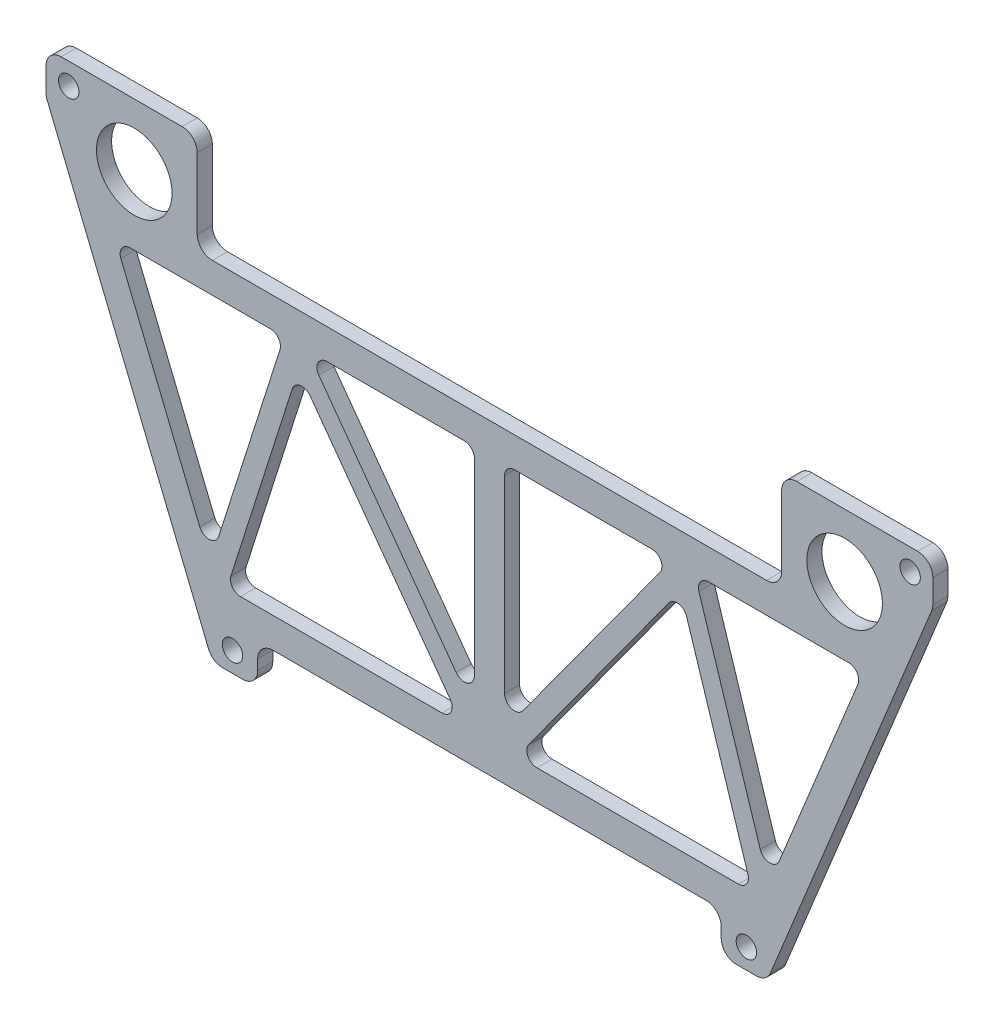
from build123d import *

# Parameters (mm, degrees)
SKETCH_1_W          = 176
SKETCH_1_H          = 89
EXTRUDE_1_DEPTH     = 3
SKETCH_2_R          = 2.025
CUT_EXTRUDE_1_DEPTH = 4
CUT_EXTRUDE_2_DEPTH = 4
SKETCH_4_W          = 116
SKETCH_4_H          = 40
CUT_EXTRUDE_3_DEPTH = 4
SKETCH_5_W          = 92
SKETCH_5_H          = 16
CUT_EXTRUDE_4_DEPTH = 4
CUT_EXTRUDE_5_DEPTH = 24
EXTRUDE_2_DEPTH     = 3
FILLET_1_R          = 2
FILLET_2_R          = 3
SKETCH_8_R          = 7.5
CUT_EXTRUDE_6_DEPTH = 3


with BuildPart() as part:
    # 草图1 → 凸台-拉伸1 (new body)
    with BuildSketch(Plane.XY):
        Rectangle(SKETCH_1_W, SKETCH_1_H)
    extrude(amount=EXTRUDE_1_DEPTH)

    # 草图2 → 切除-拉伸1 (cut)
    with BuildSketch(Plane(origin=(0, 0, 0), x_dir=(-1, 0, 0), z_dir=(0, 0, -1))):
        with Locations((-83.5, 40.2)):
            Circle(SKETCH_2_R)
        with Locations((83.5, 40.2)):
            Circle(SKETCH_2_R)
        with Locations((51, -40.5)):
            Circle(SKETCH_2_R)
        with Locations((-51, -40.5)):
            Circle(SKETCH_2_R)
    extrude(amount=-CUT_EXTRUDE_1_DEPTH, mode=Mode.SUBTRACT)

    # 草图3 → 切除-拉伸2 (cut)
    with BuildSketch(Plane(origin=(0, 0, 0), x_dir=(-1, 0, 0), z_dir=(0, 0, -1))):
        Polygon((88, -44.5), (88, 36.2), (55, -44.5), align=None)
        Polygon((-88, 36.2), (-55, -44.5), (-88, -44.5), align=None)
    extrude(amount=-CUT_EXTRUDE_2_DEPTH, mode=Mode.SUBTRACT)

    # 草图4 → 切除-拉伸3 (cut)
    with BuildSketch(Plane(origin=(0, 0, 0), x_dir=(-1, 0, 0), z_dir=(0, 0, -1))):
        with Locations((0, 44.5)):
            Rectangle(SKETCH_4_W, SKETCH_4_H)
    extrude(amount=-CUT_EXTRUDE_3_DEPTH, mode=Mode.SUBTRACT)

    # 草图5 → 切除-拉伸4 (cut)
    with BuildSketch(Plane(origin=(0, 0, 0), x_dir=(-1, 0, 0), z_dir=(0, 0, -1))):
        with Locations((0, -44.5)):
            Rectangle(SKETCH_5_W, SKETCH_5_H)
    extrude(amount=-CUT_EXTRUDE_4_DEPTH, mode=Mode.SUBTRACT)

    # 草图6 → 切除-拉伸5 (cut)
    with BuildSketch(Plane(origin=(0, 0, 0), x_dir=(-1, 0, 0), z_dir=(0, 0, -1))):
        Polygon((-3, 18.5), (-74.279812328, 18.5), (-54.242637607, -30.5), (-3, -30.5), align=None)
        Polygon((74.279812328, 18.5), (3, 18.5), (3, -30.5), (54.242637607, -30.5), align=None)
    extrude(amount=-CUT_EXTRUDE_5_DEPTH, mode=Mode.SUBTRACT)

    # 草图7 → 凸台-拉伸2 (add)
    with BuildSketch(Plane(origin=(0, 0, 0), x_dir=(-1, 0, 0), z_dir=(0, 0, -1))):
        with BuildLine():
            Line((-52.336918942, -31.106824827), (-37.933084046, 14.128069622))
            Line((-37.933084046, 14.128069622), (-4.617416544, -31.676419875))
            ThreePointArc((-4.617416544, -31.676419875), (-1.823580125, -32.117416544), (-1.382583456, -29.323580125))
            Line((-1.382583456, -29.323580125), (-39.346728283, 22.871930378))
            Line((-39.346728283, 22.871930378), (-56.148356272, -29.893175173))
            ThreePointArc((-56.148356272, -29.893175173), (-54.849462434, -32.405718665), (-52.336918942, -31.106824827))
        make_face()
        with BuildLine():
            Line((4.617416544, -31.676419875), (37.933084046, 14.128069622))
            Line((37.933084046, 14.128069622), (52.336918942, -31.106824827))
            ThreePointArc((52.336918942, -31.106824827), (54.849462434, -32.405718665), (56.148356272, -29.893175173))
            Line((56.148356272, -29.893175173), (39.346728283, 22.871930378))
            Line((39.346728283, 22.871930378), (1.382583456, -29.323580125))
            ThreePointArc((1.382583456, -29.323580125), (1.823580125, -32.117416544), (4.617416544, -31.676419875))
        make_face()
    extrude(amount=-EXTRUDE_2_DEPTH)

    # 圆角1
    fillet_1_edges = [part.edges().sort_by_distance(p)[0] for p in [
        (3, 18.5, 1.5),
        (74.279812328, 18.5, 1.5),
        (-3, 18.5, 1.5),
        (-74.279812328, 18.5, 1.5),
        (36.166826478, 18.5, 1.5),
        (40.738851866, 18.5, 1.5),
        (52.143691905, -30.5, 1.5),
        (5.473079686, -30.5, 1.5),
        (37.933084046, 14.128069622, 1.5),
        (55.422689585, -27.614236527, 1.5),
        (3, -27.099853432, 1.5),
        (-3, -27.099853432, 1.5),
        (-5.473079686, -30.5, 1.5),
        (-52.143691905, -30.5, 1.5),
        (-55.422689585, -27.614236527, 1.5),
        (-40.738851866, 18.5, 1.5),
        (-37.933084046, 14.128069622, 1.5),
        (-36.166826478, 18.5, 1.5),
    ]]
    fillet(fillet_1_edges, radius=FILLET_1_R)

    # 圆角2
    fillet_2_edges = [part.edges().sort_by_distance(p)[0] for p in [
        (88, 36.2, 1.5),
        (55, -44.5, 1.5),
        (-55, -44.5, 1.5),
        (-88, 36.2, 1.5),
        (-58, 44.5, 1.5),
        (-58, 24.5, 1.5),
        (58, 44.5, 1.5),
        (58, 24.5, 1.5),
        (-88, 44.5, 1.5),
        (88, 44.5, 1.5),
        (-46, -44.5, 1.5),
        (-46, -36.5, 1.5),
        (46, -44.5, 1.5),
        (46, -36.5, 1.5),
    ]]
    fillet(fillet_2_edges, radius=FILLET_2_R)

    # 草图8 → 切除-拉伸6 (cut)
    with BuildSketch(Plane.XY.offset(3)):
        with Locations((-70.5, 32)):
            Circle(SKETCH_8_R)
        with Locations(Location((70.5, 32, 0), (0, 0, 180))):
            Circle(SKETCH_8_R)
    extrude(amount=-CUT_EXTRUDE_6_DEPTH, mode=Mode.SUBTRACT)


solid = part.part
